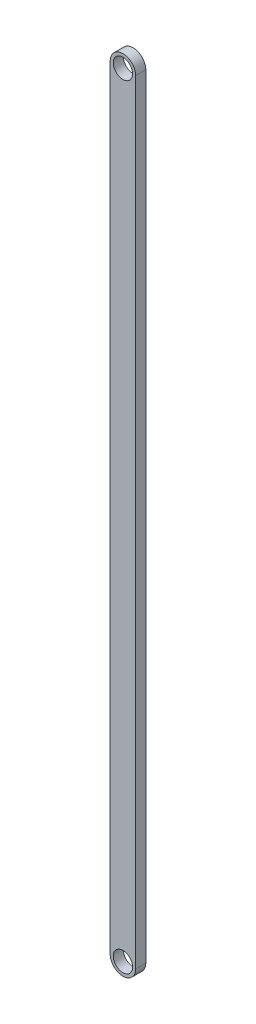
from build123d import *

# Parameters (mm, degrees)
BOSS_EXTRUDE1_DEPTH = 5.08
SKETCH2_R           = 4.826
CUT_EXTRUDE1_DEPTH  = 374.350455108


with BuildPart() as part:
    # Sketch1 → Boss-Extrude1 (new body)
    with BuildSketch(Plane.XY):
        with BuildLine():
            Line((-4.826, 19.197155715), (-4.826, -366.882844285))
            ThreePointArc((-4.826, -366.882844285), (1.524, -373.232844285), (7.874, -366.882844285))
            Line((7.874, -366.882844285), (7.874, 19.197155715))
            ThreePointArc((7.874, 19.197155715), (1.524, 25.547155715), (-4.826, 19.197155715))
        make_face()
    extrude(amount=BOSS_EXTRUDE1_DEPTH)

    # Sketch2 → Cut-Extrude1 (cut, through all)
    with BuildSketch(Plane.XY.offset(5.08)):
        with Locations((1.524, 19.197155715)):
            Circle(SKETCH2_R)
        with Locations((1.524, -366.882844285)):
            Circle(SKETCH2_R)
    extrude(amount=-CUT_EXTRUDE1_DEPTH, mode=Mode.SUBTRACT)


solid = part.part
